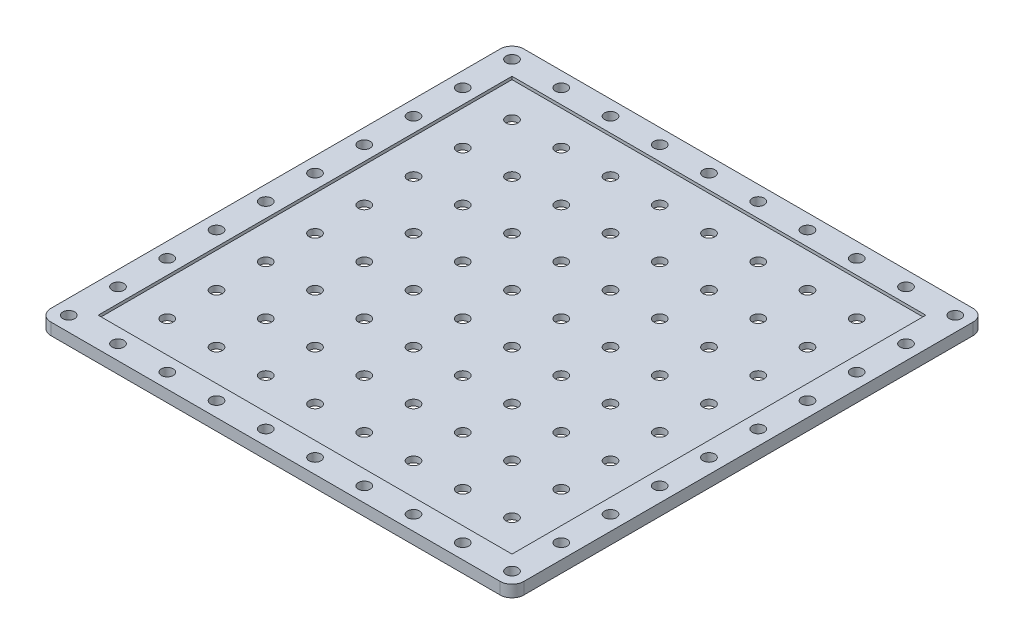
from build123d import *

# Parameters (mm, degrees)
SKETCH1_W           = 80
SKETCH1_H           = 80
BOSS_EXTRUDE1_DEPTH = 2
FILLET1_R           = 2
SKETCH3_W           = 70
SKETCH3_H           = 70
CUT_EXTRUDE2_DEPTH  = 0.5
SKETCH4_W           = 70
SKETCH4_H           = 70
CUT_EXTRUDE3_DEPTH  = 0.5
SKETCH5_R           = 1
CUT_EXTRUDE4_DEPTH  = 10


with BuildPart() as part:
    # Sketch1 → Boss-Extrude1 (new body)
    with BuildSketch(Plane(origin=(0, 0, 0), x_dir=(1, 0, 0), z_dir=(0, 1, 0))):
        Rectangle(SKETCH1_W, SKETCH1_H)
    extrude(amount=BOSS_EXTRUDE1_DEPTH)

    # Fillet1
    fillet1_edges = [part.edges().sort_by_distance(p)[0] for p in [
        (-40, 1, -40),
        (40, 1, -40),
        (40, 1, 40),
        (-40, 1, 40),
    ]]
    fillet(fillet1_edges, radius=FILLET1_R)

    # Sketch3 → Cut-Extrude2 (cut)
    with BuildSketch(Plane(origin=(0, 2, 0), x_dir=(1, 0, 0), z_dir=(0, 1, 0))):
        Rectangle(SKETCH3_W, SKETCH3_H)
    extrude(amount=-CUT_EXTRUDE2_DEPTH, mode=Mode.SUBTRACT)

    # Sketch4 → Cut-Extrude3 (cut)
    with BuildSketch(Plane.XZ):
        Rectangle(SKETCH4_W, SKETCH4_H)
    extrude(amount=-CUT_EXTRUDE3_DEPTH, mode=Mode.SUBTRACT)

    # Sketch5 → Cut-Extrude4 (cut)
    with BuildSketch(Plane(origin=(0, 2, 0), x_dir=(1, 0, 0), z_dir=(0, 1, 0))):
        with Locations(Location((37.5, -37.5, 0), (0, 0, 270))):
            Circle(SKETCH5_R)
        with Locations(Location((29.17, -37.5, 0), (0, 0, 270))):
            Circle(SKETCH5_R)
        with Locations(Location((20.84, -37.5, 0), (0, 0, 270))):
            Circle(SKETCH5_R)
        with Locations(Location((12.51, -37.5, 0), (0, 0, 270))):
            Circle(SKETCH5_R)
        with Locations(Location((4.18, -37.5, 0), (0, 0, 270))):
            Circle(SKETCH5_R)
        with Locations(Location((-4.15, -37.5, 0), (0, 0, 270))):
            Circle(SKETCH5_R)
        with Locations(Location((-12.48, -37.5, 0), (0, 0, 270))):
            Circle(SKETCH5_R)
        with Locations(Location((-20.81, -37.5, 0), (0, 0, 270))):
            Circle(SKETCH5_R)
        with Locations(Location((-29.14, -37.5, 0), (0, 0, 270))):
            Circle(SKETCH5_R)
        with Locations(Location((-37.47, -37.5, 0), (0, 0, 270))):
            Circle(SKETCH5_R)
        with Locations(Location((29.17, -29.17, 0), (0, 0, 90))):
            Circle(SKETCH5_R)
        with Locations(Location((20.84, -29.17, 0), (0, 0, 90))):
            Circle(SKETCH5_R)
        with Locations(Location((12.51, -29.17, 0), (0, 0, 90))):
            Circle(SKETCH5_R)
        with Locations(Location((4.18, -29.17, 0), (0, 0, 90))):
            Circle(SKETCH5_R)
        with Locations(Location((-4.15, -29.17, 0), (0, 0, 90))):
            Circle(SKETCH5_R)
        with Locations(Location((-12.48, -29.17, 0), (0, 0, 90))):
            Circle(SKETCH5_R)
        with Locations(Location((-20.81, -29.17, 0), (0, 0, 90))):
            Circle(SKETCH5_R)
        with Locations(Location((-29.14, -29.17, 0), (0, 0, 90))):
            Circle(SKETCH5_R)
        with Locations(Location((-37.47, -29.17, 0), (0, 0, 270))):
            Circle(SKETCH5_R)
        with Locations(Location((29.17, -20.84, 0), (0, 0, 90))):
            Circle(SKETCH5_R)
        with Locations(Location((20.84, -20.84, 0), (0, 0, 90))):
            Circle(SKETCH5_R)
        with Locations(Location((12.51, -20.84, 0), (0, 0, 90))):
            Circle(SKETCH5_R)
        with Locations(Location((4.18, -20.84, 0), (0, 0, 90))):
            Circle(SKETCH5_R)
        with Locations(Location((-4.15, -20.84, 0), (0, 0, 90))):
            Circle(SKETCH5_R)
        with Locations(Location((-12.48, -20.84, 0), (0, 0, 90))):
            Circle(SKETCH5_R)
        with Locations(Location((-20.81, -20.84, 0), (0, 0, 90))):
            Circle(SKETCH5_R)
        with Locations(Location((-29.14, -20.84, 0), (0, 0, 90))):
            Circle(SKETCH5_R)
        with Locations(Location((-37.47, -20.84, 0), (0, 0, 270))):
            Circle(SKETCH5_R)
        with Locations(Location((29.17, -12.51, 0), (0, 0, 90))):
            Circle(SKETCH5_R)
        with Locations(Location((20.84, -12.51, 0), (0, 0, 90))):
            Circle(SKETCH5_R)
        with Locations(Location((12.51, -12.51, 0), (0, 0, 90))):
            Circle(SKETCH5_R)
        with Locations(Location((4.18, -12.51, 0), (0, 0, 90))):
            Circle(SKETCH5_R)
        with Locations(Location((-4.15, -12.51, 0), (0, 0, 90))):
            Circle(SKETCH5_R)
        with Locations(Location((-12.48, -12.51, 0), (0, 0, 90))):
            Circle(SKETCH5_R)
        with Locations(Location((-20.81, -12.51, 0), (0, 0, 90))):
            Circle(SKETCH5_R)
        with Locations(Location((-29.14, -12.51, 0), (0, 0, 90))):
            Circle(SKETCH5_R)
        with Locations(Location((-37.47, -12.51, 0), (0, 0, 270))):
            Circle(SKETCH5_R)
        with Locations(Location((29.17, -4.18, 0), (0, 0, 90))):
            Circle(SKETCH5_R)
        with Locations(Location((20.84, -4.18, 0), (0, 0, 90))):
            Circle(SKETCH5_R)
        with Locations(Location((12.51, -4.18, 0), (0, 0, 90))):
            Circle(SKETCH5_R)
        with Locations(Location((4.18, -4.18, 0), (0, 0, 90))):
            Circle(SKETCH5_R)
        with Locations(Location((-4.15, -4.18, 0), (0, 0, 90))):
            Circle(SKETCH5_R)
        with Locations(Location((-12.48, -4.18, 0), (0, 0, 90))):
            Circle(SKETCH5_R)
        with Locations(Location((-20.81, -4.18, 0), (0, 0, 90))):
            Circle(SKETCH5_R)
        with Locations(Location((-29.14, -4.18, 0), (0, 0, 90))):
            Circle(SKETCH5_R)
        with Locations(Location((-37.47, -4.18, 0), (0, 0, 270))):
            Circle(SKETCH5_R)
        with Locations(Location((29.17, 4.15, 0), (0, 0, 90))):
            Circle(SKETCH5_R)
        with Locations(Location((20.84, 4.15, 0), (0, 0, 90))):
            Circle(SKETCH5_R)
        with Locations(Location((12.51, 4.15, 0), (0, 0, 90))):
            Circle(SKETCH5_R)
        with Locations(Location((4.18, 4.15, 0), (0, 0, 90))):
            Circle(SKETCH5_R)
        with Locations(Location((-4.15, 4.15, 0), (0, 0, 90))):
            Circle(SKETCH5_R)
        with Locations(Location((-12.48, 4.15, 0), (0, 0, 90))):
            Circle(SKETCH5_R)
        with Locations(Location((-20.81, 4.15, 0), (0, 0, 90))):
            Circle(SKETCH5_R)
        with Locations(Location((-29.14, 4.15, 0), (0, 0, 90))):
            Circle(SKETCH5_R)
        with Locations(Location((-37.47, 4.15, 0), (0, 0, 270))):
            Circle(SKETCH5_R)
        with Locations(Location((29.17, 12.48, 0), (0, 0, 90))):
            Circle(SKETCH5_R)
        with Locations(Location((20.84, 12.48, 0), (0, 0, 90))):
            Circle(SKETCH5_R)
        with Locations(Location((12.51, 12.48, 0), (0, 0, 90))):
            Circle(SKETCH5_R)
        with Locations(Location((4.18, 12.48, 0), (0, 0, 90))):
            Circle(SKETCH5_R)
        with Locations(Location((-4.15, 12.48, 0), (0, 0, 90))):
            Circle(SKETCH5_R)
        with Locations(Location((-12.48, 12.48, 0), (0, 0, 90))):
            Circle(SKETCH5_R)
        with Locations(Location((-20.81, 12.48, 0), (0, 0, 90))):
            Circle(SKETCH5_R)
        with Locations(Location((-29.14, 12.48, 0), (0, 0, 90))):
            Circle(SKETCH5_R)
        with Locations(Location((-37.47, 12.48, 0), (0, 0, 270))):
            Circle(SKETCH5_R)
        with Locations(Location((29.17, 20.81, 0), (0, 0, 90))):
            Circle(SKETCH5_R)
        with Locations(Location((20.84, 20.81, 0), (0, 0, 90))):
            Circle(SKETCH5_R)
        with Locations(Location((12.51, 20.81, 0), (0, 0, 90))):
            Circle(SKETCH5_R)
        with Locations(Location((4.18, 20.81, 0), (0, 0, 90))):
            Circle(SKETCH5_R)
        with Locations(Location((-4.15, 20.81, 0), (0, 0, 90))):
            Circle(SKETCH5_R)
        with Locations(Location((-12.48, 20.81, 0), (0, 0, 90))):
            Circle(SKETCH5_R)
        with Locations(Location((-20.81, 20.81, 0), (0, 0, 90))):
            Circle(SKETCH5_R)
        with Locations(Location((-29.14, 20.81, 0), (0, 0, 90))):
            Circle(SKETCH5_R)
        with Locations(Location((-37.47, 20.81, 0), (0, 0, 270))):
            Circle(SKETCH5_R)
        with Locations(Location((29.17, 29.14, 0), (0, 0, 90))):
            Circle(SKETCH5_R)
        with Locations(Location((20.84, 29.14, 0), (0, 0, 90))):
            Circle(SKETCH5_R)
        with Locations(Location((12.51, 29.14, 0), (0, 0, 90))):
            Circle(SKETCH5_R)
        with Locations(Location((4.18, 29.14, 0), (0, 0, 90))):
            Circle(SKETCH5_R)
        with Locations(Location((-4.15, 29.14, 0), (0, 0, 90))):
            Circle(SKETCH5_R)
        with Locations(Location((-12.48, 29.14, 0), (0, 0, 90))):
            Circle(SKETCH5_R)
        with Locations(Location((-20.81, 29.14, 0), (0, 0, 90))):
            Circle(SKETCH5_R)
        with Locations(Location((-29.14, 29.14, 0), (0, 0, 90))):
            Circle(SKETCH5_R)
        with Locations(Location((-37.47, 29.14, 0), (0, 0, 270))):
            Circle(SKETCH5_R)
        with Locations(Location((29.17, 37.47, 0), (0, 0, 270))):
            Circle(SKETCH5_R)
        with Locations(Location((20.84, 37.47, 0), (0, 0, 270))):
            Circle(SKETCH5_R)
        with Locations(Location((12.51, 37.47, 0), (0, 0, 270))):
            Circle(SKETCH5_R)
        with Locations(Location((4.18, 37.47, 0), (0, 0, 270))):
            Circle(SKETCH5_R)
        with Locations(Location((-4.15, 37.47, 0), (0, 0, 270))):
            Circle(SKETCH5_R)
        with Locations(Location((-12.48, 37.47, 0), (0, 0, 270))):
            Circle(SKETCH5_R)
        with Locations(Location((-20.81, 37.47, 0), (0, 0, 270))):
            Circle(SKETCH5_R)
        with Locations(Location((-29.14, 37.47, 0), (0, 0, 270))):
            Circle(SKETCH5_R)
        with Locations(Location((-37.47, 37.47, 0), (0, 0, 270))):
            Circle(SKETCH5_R)
        with Locations(Location((37.5, -29.17, 0), (0, 0, 270))):
            Circle(SKETCH5_R)
        with Locations(Location((37.5, -20.84, 0), (0, 0, 270))):
            Circle(SKETCH5_R)
        with Locations(Location((37.5, -12.51, 0), (0, 0, 270))):
            Circle(SKETCH5_R)
        with Locations(Location((37.5, -4.18, 0), (0, 0, 270))):
            Circle(SKETCH5_R)
        with Locations(Location((37.5, 4.15, 0), (0, 0, 270))):
            Circle(SKETCH5_R)
        with Locations(Location((37.5, 12.48, 0), (0, 0, 270))):
            Circle(SKETCH5_R)
        with Locations(Location((37.5, 20.81, 0), (0, 0, 270))):
            Circle(SKETCH5_R)
        with Locations(Location((37.5, 29.14, 0), (0, 0, 270))):
            Circle(SKETCH5_R)
        with Locations(Location((37.5, 37.47, 0), (0, 0, 270))):
            Circle(SKETCH5_R)
    extrude(amount=-CUT_EXTRUDE4_DEPTH, mode=Mode.SUBTRACT)


solid = part.part
